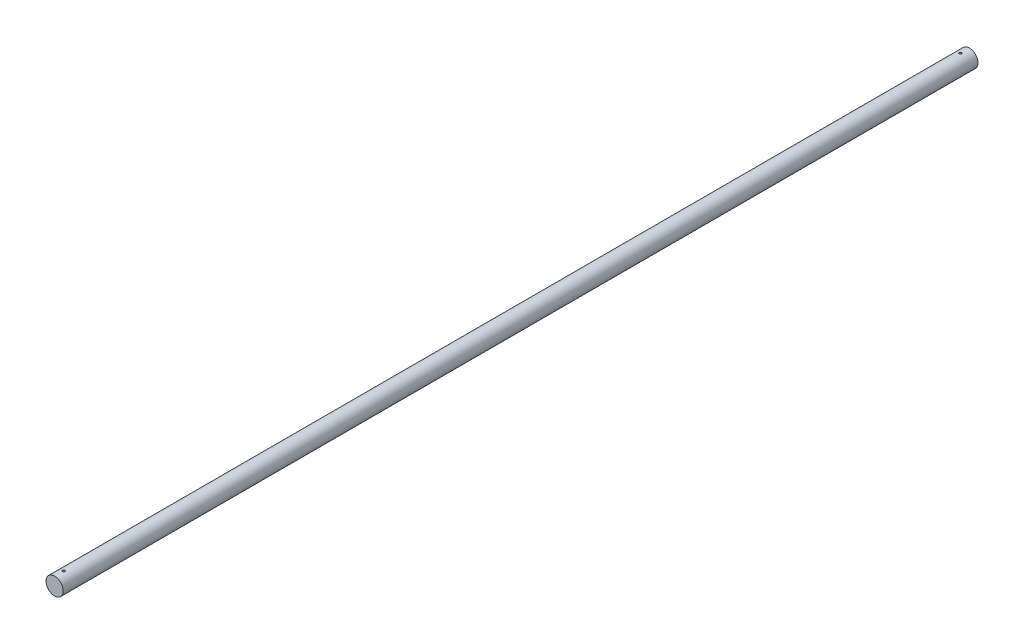
from build123d import *

# Parameters (mm, degrees)
SKETCH1_R           = 5.55625
BOSS_EXTRUDE1_DEPTH = 294.64
SKETCH4_R           = 0.762
CUT_EXTRUDE1_DEPTH  = 6.858


with BuildPart() as part:
    # Sketch1 → Boss-Extrude1 (new, symmetric)
    with BuildSketch(Plane.XY):
        Circle(SKETCH1_R)
    extrude(amount=BOSS_EXTRUDE1_DEPTH, both=True)

    # Sketch4 → Cut-Extrude1 (cut, symmetric)
    with BuildSketch(Plane(origin=(0, 0, 0), x_dir=(1, 0, 0), z_dir=(0, 1, 0))):
        with Locations(Location((0, -288.798, 0), (0, 0, 270))):
            Circle(SKETCH4_R)
        with Locations(Location((0, 288.798, 0), (0, 0, 270))):
            Circle(SKETCH4_R)
    extrude(amount=CUT_EXTRUDE1_DEPTH, both=True, mode=Mode.SUBTRACT)


solid = part.part
